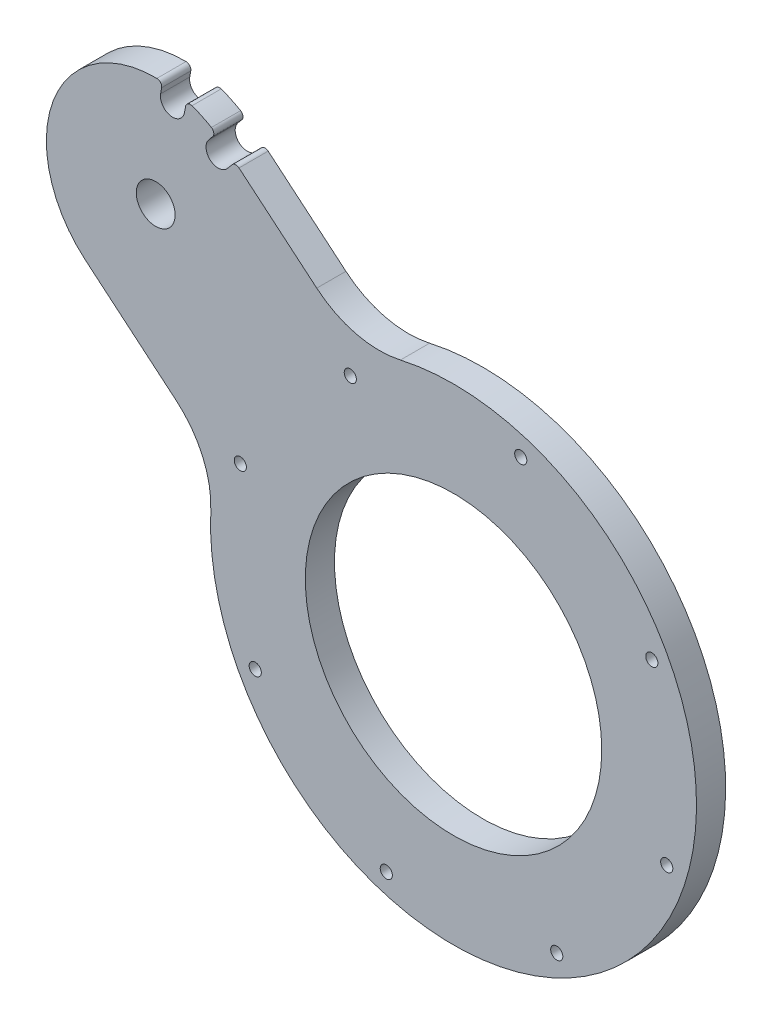
from build123d import *

# Parameters (mm, degrees)
EXTRUDE_2_DEPTH      = 1
EXTRUDE_2_DEPTH_BACK = 5
SKETCH_1_R           = 4
SKETCH_2_R           = 1.25
SKETCH_2_R_2         = 30.5
CUT_EXTRUDE_1_DEPTH  = 10
SKETCH_3_R           = 2.5
CUT_EXTRUDE_2_DEPTH  = 1.5


with BuildPart() as part:
    # 草图1 → 凸台-拉伸2 (new, two sides: drawn at the far end of the back side and taken through both)
    with BuildSketch(Plane.XY.offset(-EXTRUDE_2_DEPTH_BACK)):
        with BuildLine():
            Line((-28.145811083, 52.988803709), (-44.139678681, 66.409252111))
            ThreePointArc((-44.139678681, 66.409252111), (-44.869622033, 66.639402366), (-45.548510733, 66.285995278))
            Line((-45.548510733, 66.285995278), (-46.512692148, 65.136928613))
            ThreePointArc((-46.512692148, 65.136928613), (-50.03477228, 64.82878653), (-50.342914364, 68.350866662))
            Line((-50.342914364, 68.350866662), (-49.563082227, 69.280234412))
            ThreePointArc((-49.563082227, 69.280234412), (-49.343377533, 70.09124401), (-49.819618355, 70.783487754))
            ThreePointArc((-49.819618355, 70.783487754), (-51.77464456, 71.814933983), (-53.821444834, 72.649570088))
            ThreePointArc((-53.821444834, 72.649570088), (-54.657856007, 72.569426022), (-55.137901948, 71.87981554))
            Line((-55.137901948, 71.87981554), (-55.348572514, 70.685043391))
            ThreePointArc((-55.348572514, 70.685043391), (-58.24471234, 68.657144453), (-60.272611279, 71.553284279))
            Line((-60.272611279, 71.553284279), (-60.061940713, 72.748056429))
            ThreePointArc((-60.061940713, 72.748056429), (-60.277175665, 73.560263691), (-61.035734188, 73.921643947))
            ThreePointArc((-61.035734188, 73.921643947), (-82.383938211, 59.234784971), (-75.746276667, 34.187008805))
            Line((-75.746276667, 34.187008805), (-57.071253519, 18.516803768))
            ThreePointArc((-57.071253519, 18.516803768), (-51.612575359, 11.232185237), (-49.947861223, 2.282796361))
            ThreePointArc((-49.947861223, 2.282796361), (38.302222156, -32.139380484), (-10.921470635, 48.792637551))
            ThreePointArc((-10.921470635, 48.792637551), (-20.02397276, 48.878015869), (-28.145811083, 52.988803709))
        make_face()
        with Locations((-61.28355545, 51.423008775)):
            Circle(SKETCH_1_R, mode=Mode.SUBTRACT)
    extrude(amount=EXTRUDE_2_DEPTH + EXTRUDE_2_DEPTH_BACK)

    # 草图2 → 切除-拉伸1 (cut)
    with BuildSketch(Plane.XY.offset(1)):
        with Locations((-21.240436209, 40.802498326)):
            Circle(SKETCH_2_R)
        with Locations((13.832466777, 43.870979734)):
            Circle(SKETCH_2_R)
        with Locations((40.802498326, 21.240436209)):
            Circle(SKETCH_2_R)
        with Locations((43.870979734, -13.832466777)):
            Circle(SKETCH_2_R)
        with Locations((21.240436209, -40.802498326)):
            Circle(SKETCH_2_R)
        with Locations((-13.832466777, -43.870979734)):
            Circle(SKETCH_2_R)
        with Locations((-40.802498326, -21.240436209)):
            Circle(SKETCH_2_R)
        with Locations((-43.870979734, 13.832466777)):
            Circle(SKETCH_2_R)
        Circle(SKETCH_2_R_2)
    extrude(amount=-CUT_EXTRUDE_1_DEPTH, mode=Mode.SUBTRACT)

    # 草图3 → 切除-拉伸2 (cut)
    with BuildSketch(Plane(origin=(0, 0, -5), x_dir=(-1, 0, 0), z_dir=(0, 0, -1))):
        with Locations((-13.832466777, 43.870979734)):
            Circle(SKETCH_3_R)
        with Locations((21.240436209, 40.802498326)):
            Circle(SKETCH_3_R)
        with Locations((43.870979734, 13.832466777)):
            Circle(SKETCH_3_R)
        with Locations((40.802498326, -21.240436209)):
            Circle(SKETCH_3_R)
        with Locations((13.832466777, -43.870979734)):
            Circle(SKETCH_3_R)
        with Locations((-21.240436209, -40.802498326)):
            Circle(SKETCH_3_R)
        with Locations((-43.870979734, -13.832466777)):
            Circle(SKETCH_3_R)
        with Locations((-40.802498326, 21.240436209)):
            Circle(SKETCH_3_R)
    extrude(amount=-CUT_EXTRUDE_2_DEPTH, mode=Mode.SUBTRACT)


solid = part.part
